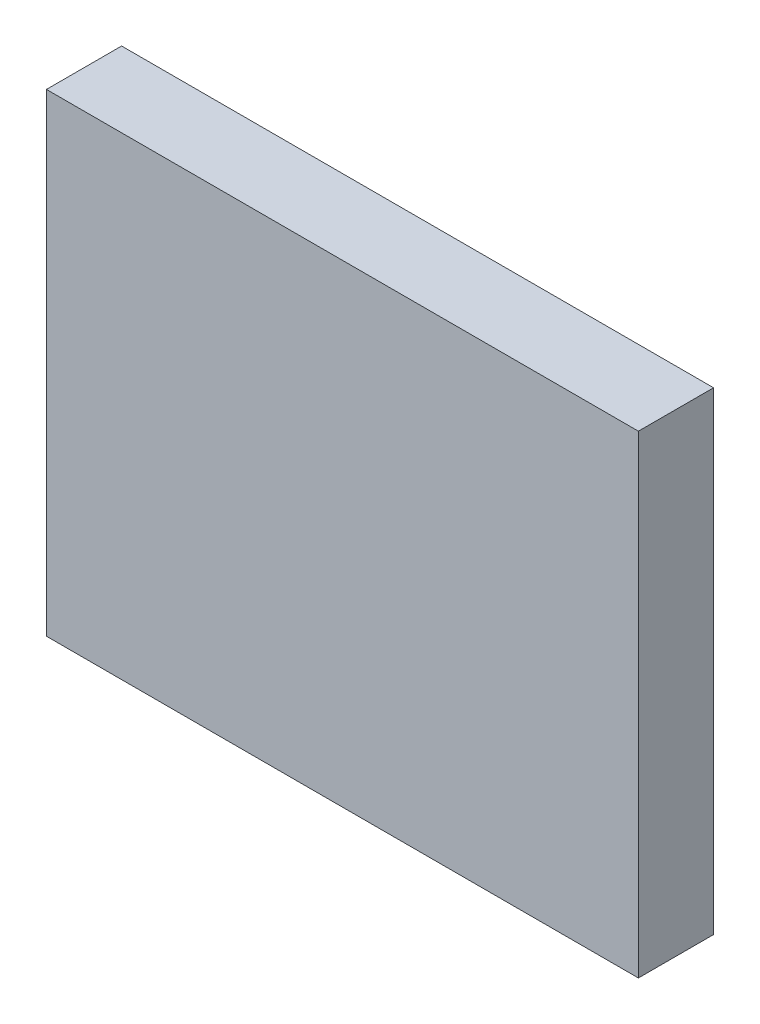
from build123d import *

# Parameters (mm, degrees)
SKETCH1_W           = 200
SKETCH1_H           = 160
BOSS_EXTRUDE1_DEPTH = 25.4


with BuildPart() as part:
    # Sketch1 → Boss-Extrude1 (new body)
    with BuildSketch(Plane.XY):
        Rectangle(SKETCH1_W, SKETCH1_H)
    extrude(amount=BOSS_EXTRUDE1_DEPTH)


solid = part.part
